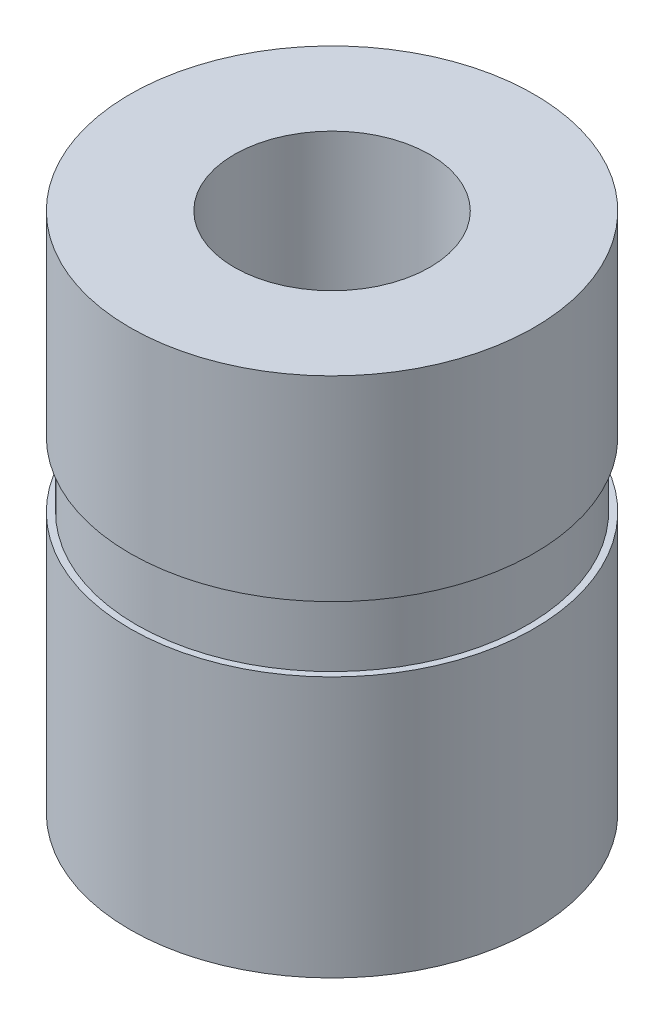
from build123d import *

# Parameters (mm, degrees)
SCHIZZO1_R                   = 3.1
ESTRUSIONE_ESTRUSIONE1_DEPTH = 4
SCHIZZO1_3_R                 = 3
ESTRUSIONE_ESTRUSIONE2_DEPTH = 5
ESTRUSIONE_ESTRUSIONE3_START = 5
SCHIZZO1_4_R                 = 3.1
SCHIZZO1_4_R_2               = 1.5
ESTRUSIONE_ESTRUSIONE3_DEPTH = 3


with BuildPart() as part:
    # Schizzo1 → Estrusione-Estrusione1 (new body)
    with BuildSketch(Plane(origin=(0, 0, 0), x_dir=(1, 0, 0), z_dir=(0, 1, 0))):
        with Locations(Location((0, 0, 0), (0, 0, 270))):
            Circle(SCHIZZO1_R)
    extrude(amount=ESTRUSIONE_ESTRUSIONE1_DEPTH)

    # Schizzo1<3> → Estrusione-Estrusione2 (add)
    with BuildSketch(Plane(origin=(0, 0, 0), x_dir=(1, 0, 0), z_dir=(0, 1, 0))):
        with Locations(Location((0, 0, 0), (0, 0, 270))):
            Circle(SCHIZZO1_3_R)
    extrude(amount=ESTRUSIONE_ESTRUSIONE2_DEPTH)

    # Schizzo1<4> → Estrusione-Estrusione3 (add)
    with BuildSketch(Plane(origin=(0, 0, 0), x_dir=(1, 0, 0), z_dir=(0, 1, 0)).offset(ESTRUSIONE_ESTRUSIONE3_START)):
        with Locations(Location((0, 0, 0), (0, 0, 270))):
            Circle(SCHIZZO1_4_R)
        with Locations(Location((0, 0, 0), (0, 0, 270))):
            Circle(SCHIZZO1_4_R_2, mode=Mode.SUBTRACT)
    extrude(amount=ESTRUSIONE_ESTRUSIONE3_DEPTH)


solid = part.part
